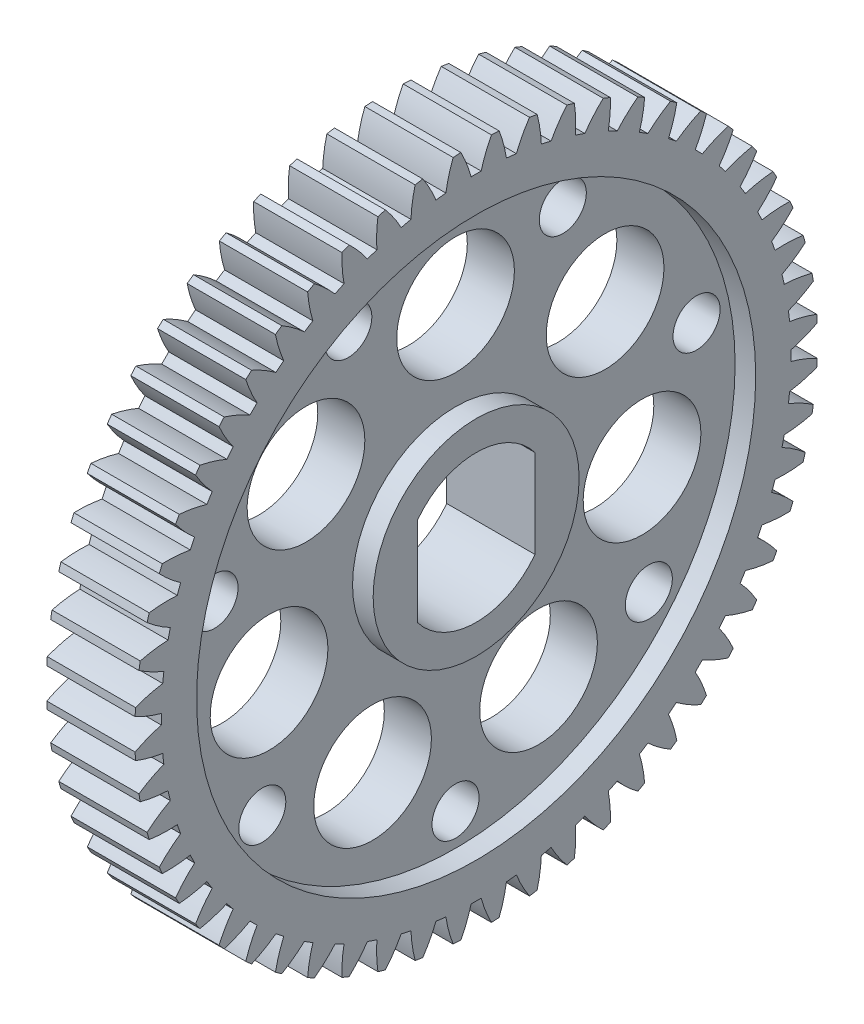
from build123d import *

# Parameters (mm, degrees)
BASPROSKE_W              = 15
BASPROSKE_H              = 58
TOOTHCUT_DEPTH           = 84.384650866
TEETHCUTS_COUNT          = 56
TEETHCUTS_ANGLE          = 353.571428571
BORSKE_R                 = 0.4
BORE_DEPTH               = 50.0000508
SKETCH1_R                = 47.5
CUT_EXTRUDE1_DEPTH       = 3.5
CUT_EXTRUDE2_START       = -11.5
SKETCH1_2_R              = 47.5
CUT_EXTRUDE2_DEPTH       = 3.5
BOSS_EXTRUDE1_DEPTH      = 3.5
BOSS_EXTRUDE1_DEPTH_BACK = 11.5
SKETCH3_R                = 17.5
CUT_EXTRUDE3_DEPTH       = 84.303851764
SKETCH5_R                = 10
CUT_EXTRUDE4_DEPTH       = 83.745282153
CIRPATTERN1_COUNT        = 7
SKETCH6_R                = 4
CUT_EXTRUDE5_DEPTH       = 83.745282153
CIRPATTERN2_COUNT        = 7


with BuildPart() as part:
    # BasProSke → Base-Revolve (revolve)
    with BuildSketch(Plane(origin=(0, 0, 0), x_dir=(1, 0, 0), z_dir=(0, 1, 0)), mode=Mode.PRIVATE) as base_revolve_sk:
        with Locations((7.5, 29)):
            Rectangle(BASPROSKE_W, BASPROSKE_H)
    revolve(base_revolve_sk.sketch.rotate(Axis((-10, 0, 0), (1, 0, 0)), 180), axis=Axis((-10, 0, 0), (1, 0, 0)))

    # TooCutSke → ToothCut (cut, through all)
    with BuildSketch(Plane(origin=(0, 0, 0), x_dir=(0, 0, -1), z_dir=(1, 0, 0))):
        with BuildLine():
            ThreePointArc((0.850924682, 53.49223241), (0, 53.499), (-0.850924682, 53.49223241))
            ThreePointArc((-0.850924682, 53.49223241), (-1.609077718, 55.776767743), (-2.607989735, 57.966761465))
            ThreePointArc((-2.607989735, 57.966761465), (0, 58.0254), (2.607989735, 57.966761465))
            ThreePointArc((2.607989735, 57.966761465), (1.609077718, 55.776767743), (0.850924682, 53.49223241))
        make_face()
    toothcut = extrude(amount=TOOTHCUT_DEPTH, mode=Mode.SUBTRACT)

    # TeethCuts: ToothCut ×56 about axis
    teethcuts_axis = Axis((-10, 0, 0), (1, 0, 0))
    for i in range(1, TEETHCUTS_COUNT):
        add(toothcut.rotate(teethcuts_axis, i * TEETHCUTS_ANGLE / (TEETHCUTS_COUNT - 1)), mode=Mode.SUBTRACT)

    # BorSke → Bore (cut, symmetric)
    with BuildSketch(Plane(origin=(0, 0, 0), x_dir=(0, 0, -1), z_dir=(1, 0, 0))):
        with Locations(Location((0, 0, 0), (0, 0, 180))):
            Circle(BORSKE_R)
    extrude(amount=BORE_DEPTH, both=True, mode=Mode.SUBTRACT)

    # Sketch1 → Cut-Extrude1 (cut)
    with BuildSketch(Plane(origin=(15, 0, 0), x_dir=(0, 0, -1), z_dir=(1, 0, 0))):
        Circle(SKETCH1_R)
    extrude(amount=-CUT_EXTRUDE1_DEPTH, mode=Mode.SUBTRACT)

    # Sketch1<2> → Cut-Extrude2 (cut)
    with BuildSketch(Plane(origin=(15, 0, 0), x_dir=(0, 0, -1), z_dir=(1, 0, 0)).offset(CUT_EXTRUDE2_START)):
        Circle(SKETCH1_2_R)
    extrude(amount=-CUT_EXTRUDE2_DEPTH, mode=Mode.SUBTRACT)

    # Sketch3 → Boss-Extrude1 (add, two sides: drawn at the far end of the back side and taken through both)
    with BuildSketch(Plane(origin=(11.5, 0, 0), x_dir=(0, 0, -1), z_dir=(1, 0, 0)).offset(-BOSS_EXTRUDE1_DEPTH_BACK)):
        Circle(SKETCH3_R)
    extrude(amount=BOSS_EXTRUDE1_DEPTH + BOSS_EXTRUDE1_DEPTH_BACK)

    # Sketch4 → Cut-Extrude3 (cut, through all)
    with BuildSketch(Plane(origin=(15, 0, 0), x_dir=(0, 0, -1), z_dir=(1, 0, 0))):
        with BuildLine():
            Line((-10, 7.5), (-10, -7.5))
            ThreePointArc((-10, -7.5), (0, -12.5), (10, -7.5))
            Line((10, -7.5), (10, 7.5))
            ThreePointArc((10, 7.5), (0, 12.5), (-10, 7.5))
        make_face()
    extrude(amount=-CUT_EXTRUDE3_DEPTH, mode=Mode.SUBTRACT)

    # Sketch5 → Cut-Extrude4 (cut, through all)
    with BuildSketch(Plane(origin=(11.5, 0, 0), x_dir=(0, 0, -1), z_dir=(1, 0, 0))):
        with Locations((0, 32.5)):
            Circle(SKETCH5_R)
    cut_extrude4 = extrude(amount=-CUT_EXTRUDE4_DEPTH, mode=Mode.SUBTRACT)

    # CirPattern1: Cut-Extrude4 ×7 about axis
    cirpattern1_axis = Axis((0, 0, 0), (1, 0, 0))
    for i in range(1, CIRPATTERN1_COUNT):
        add(cut_extrude4.rotate(cirpattern1_axis, i * 360 / CIRPATTERN1_COUNT), mode=Mode.SUBTRACT)

    # Sketch6 → Cut-Extrude5 (cut, through all)
    with BuildSketch(Plane(origin=(11.5, 0, 0), x_dir=(0, 0, -1), z_dir=(1, 0, 0))):
        with Locations((18.223117043, 37.840692452)):
            Circle(SKETCH6_R)
    cut_extrude5 = extrude(amount=-CUT_EXTRUDE5_DEPTH, mode=Mode.SUBTRACT)

    # CirPattern2: Cut-Extrude5 ×7 about axis
    cirpattern2_axis = Axis((0, 0, 0), (1, 0, 0))
    for i in range(1, CIRPATTERN2_COUNT):
        add(cut_extrude5.rotate(cirpattern2_axis, i * 360 / CIRPATTERN2_COUNT), mode=Mode.SUBTRACT)


solid = part.part
